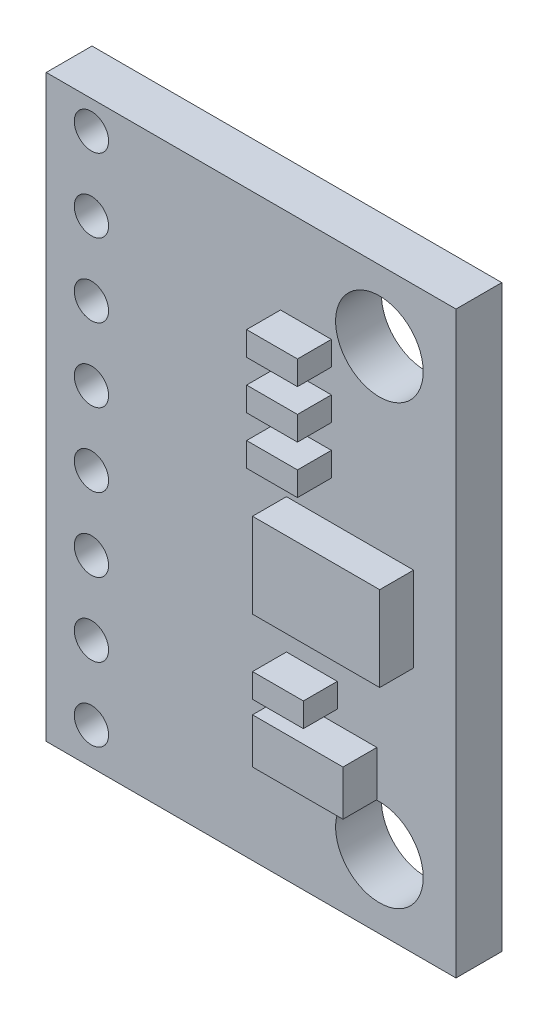
from build123d import *

# Parameters (mm, degrees)
SKETCH1_W           = 14.5
SKETCH1_H           = 20.5
BOSS_EXTRUDE1_DEPTH = 1.62
SKETCH2_R           = 1.55
CUT_EXTRUDE1_DEPTH  = 1.62
SKETCH3_W           = 1.8
SKETCH3_H           = 0.85
SKETCH3_W_2         = 4.5
SKETCH3_H_2         = 3
SKETCH3_W_3         = 3.2
SKETCH3_H_3         = 1.6
BOSS_EXTRUDE2_DEPTH = 1.2
SKETCH4_R           = 0.607226872
CUT_EXTRUDE2_DEPTH  = 13.658965203


with BuildPart() as part:
    # Sketch1 → Boss-Extrude1 (new body)
    with BuildSketch(Plane.XY):
        Rectangle(SKETCH1_W, SKETCH1_H)
    extrude(amount=BOSS_EXTRUDE1_DEPTH)

    # Sketch2 → Cut-Extrude1 (cut)
    with BuildSketch(Plane.XY.offset(1.62)):
        with Locations((4.54, 7.75)):
            Circle(SKETCH2_R)
        with Locations((4.54, -7.75)):
            Circle(SKETCH2_R)
    extrude(amount=-CUT_EXTRUDE1_DEPTH, mode=Mode.SUBTRACT)

    # Sketch3 → Boss-Extrude2 (add)
    with BuildSketch(Plane.XY.offset(1.62)):
        with Locations((1.94, 6.69017984)):
            Rectangle(SKETCH3_W, SKETCH3_H)
        with Locations((1.94, 4.99017984)):
            Rectangle(SKETCH3_W, SKETCH3_H)
        with Locations((1.94, 3.29017984)):
            Rectangle(SKETCH3_W, SKETCH3_H)
        with Locations((3.5, 0)):
            Rectangle(SKETCH3_W_2, SKETCH3_H_2)
        with Locations((2.15, -3.68482016)):
            Rectangle(SKETCH3_W, SKETCH3_H)
        with Locations((2.85, -5.38482016)):
            Rectangle(SKETCH3_W_3, SKETCH3_H_3)
    extrude(amount=BOSS_EXTRUDE2_DEPTH)

    # Sketch4 → Cut-Extrude2 (cut, through all)
    with BuildSketch(Plane.XY.offset(1.62)):
        with Locations((-5.65, 9.25)):
            Circle(SKETCH4_R)
        with Locations((-5.65, 6.65)):
            Circle(SKETCH4_R)
        with Locations((-5.65, 4.05)):
            Circle(SKETCH4_R)
        with Locations((-5.65, 1.45)):
            Circle(SKETCH4_R)
        with Locations((-5.65, -1.15)):
            Circle(SKETCH4_R)
        with Locations((-5.65, -3.75)):
            Circle(SKETCH4_R)
        with Locations((-5.65, -6.35)):
            Circle(SKETCH4_R)
        with Locations((-5.65, -8.95)):
            Circle(SKETCH4_R)
        with Locations((-5.65, -11.55)):
            Circle(SKETCH4_R)
        with Locations((-5.65, -14.15)):
            Circle(SKETCH4_R)
    extrude(amount=-CUT_EXTRUDE2_DEPTH, mode=Mode.SUBTRACT)


solid = part.part
